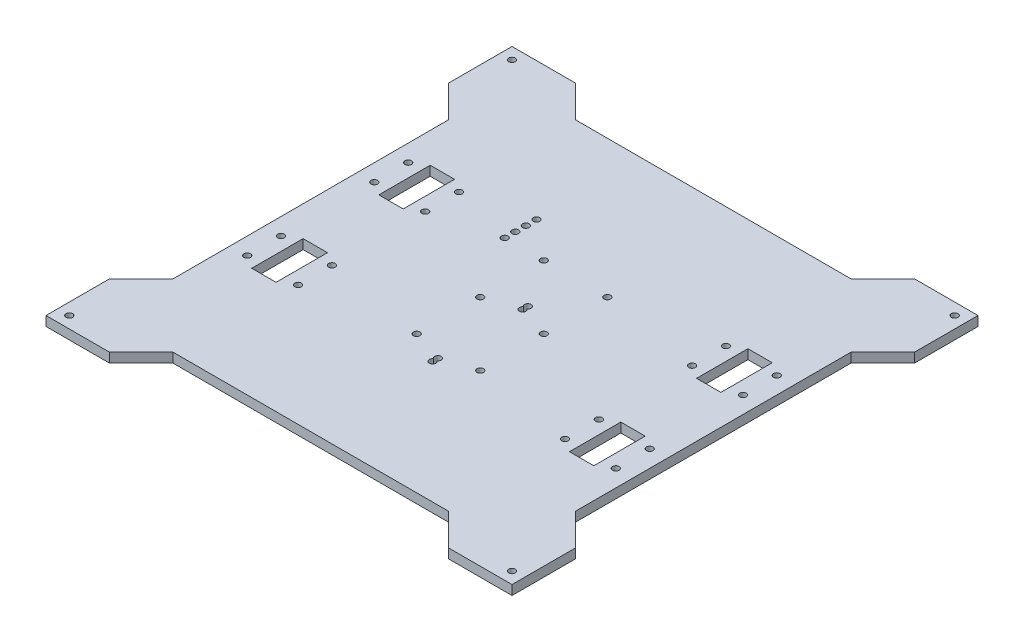
from build123d import *

# Parameters (mm, degrees)
SKETCH1_W            = 220
SKETCH1_H            = 220
SQUARE_DEPTH         = 4.5
SKETCH2_R            = 1.55
LM8UU_HOLDERS_DEPTH  = 156.628564216
SKETCH3_R            = 1.55
DEFAULTBELT_DEPTH    = 156.628564216
BELTOPTIONS_DEPTH    = 156.628564216
SKETCH5_OUTSIDE_W    = 284.232
SKETCH5_OUTSIDE_H    = 284.232
SKETCH5_OUTSIDE_R    = 1.55
SHAPING_DEPTH        = 10
SKETCH6_R            = 1.55
CUT_EXTRUDE5_DEPTH   = 156.628564216
SKETCH7_W            = 11.5
SKETCH7_H            = 24.25
CUT_EXTRUDE6_DEPTH   = 156.628564216
SKETCH8_R            = 1.55
ENDSTOPTRIGGER_DEPTH = 156.628564216
LPATTERN1_COUNT      = 2
LPATTERN1_PITCH      = 30


with BuildPart() as part:
    # Sketch1 → Square (new body)
    with BuildSketch(Plane(origin=(0, 0, 0), x_dir=(1, 0, 0), z_dir=(0, 1, 0))):
        Rectangle(SKETCH1_W, SKETCH1_H)
    extrude(amount=SQUARE_DEPTH)

    # Sketch2 → LM8UU-Holders (cut, through all)
    with BuildSketch(Plane(origin=(0, 4.5, 0), x_dir=(1, 0, 0), z_dir=(0, 1, 0))):
        with Locations((87, 38)):
            Circle(SKETCH2_R)
        with Locations((87, 22)):
            Circle(SKETCH2_R)
        with Locations((63, 22)):
            Circle(SKETCH2_R)
        with Locations((63, 38)):
            Circle(SKETCH2_R)
        with Locations((-63, 38)):
            Circle(SKETCH2_R)
        with Locations((-63, 22)):
            Circle(SKETCH2_R)
        with Locations((-87, 22)):
            Circle(SKETCH2_R)
        with Locations((-87, 38)):
            Circle(SKETCH2_R)
        with Locations((87, -22)):
            Circle(SKETCH2_R)
        with Locations((87, -38)):
            Circle(SKETCH2_R)
        with Locations((63, -38)):
            Circle(SKETCH2_R)
        with Locations((63, -22)):
            Circle(SKETCH2_R)
        with Locations((-63, -22)):
            Circle(SKETCH2_R)
        with Locations((-63, -38)):
            Circle(SKETCH2_R)
        with Locations((-87, -38)):
            Circle(SKETCH2_R)
        with Locations((-87, -22)):
            Circle(SKETCH2_R)
    extrude(amount=-LM8UU_HOLDERS_DEPTH, mode=Mode.SUBTRACT)

    # Sketch3 → DefaultBelt (cut, through all)
    with BuildSketch(Plane(origin=(0, 4.5, 0), x_dir=(1, 0, 0), z_dir=(0, 1, 0))):
        with Locations((-15, -30)):
            Circle(SKETCH3_R)
        with Locations((15, -30)):
            Circle(SKETCH3_R)
        with Locations((15, 0)):
            Circle(SKETCH3_R)
        with Locations((-15, 0)):
            Circle(SKETCH3_R)
    defaultbelt = extrude(amount=-DEFAULTBELT_DEPTH, mode=Mode.SUBTRACT)

    # Sketch4 → BeltOptions (cut, through all)
    with BuildSketch(Plane(origin=(0, 4.5, 0), x_dir=(1, 0, 0), z_dir=(0, 1, 0))):
        with BuildLine():
            ThreePointArc((-0.916515139, 6.25), (0, 3.45), (0.916515139, 6.25))
            ThreePointArc((0.916515139, 6.25), (0, 9.05), (-0.916515139, 6.25))
        make_face()
        with BuildLine():
            ThreePointArc((0.916515139, -36.25), (0, -39.05), (-0.916515139, -36.25))
            ThreePointArc((-0.916515139, -36.25), (0, -33.45), (0.916515139, -36.25))
        make_face()
    extrude(amount=-BELTOPTIONS_DEPTH, mode=Mode.SUBTRACT)

    # Sketch5 outside → Shaping (cut)
    # profile 1 of 15: a face of its own
    with BuildSketch(Plane(origin=(0, 4.5, 0), x_dir=(1, 0, 0), z_dir=(0, 1, 0))):
        Rectangle(SKETCH5_OUTSIDE_W, SKETCH5_OUTSIDE_H)
        Polygon((-80, 110), (-110, 110), (-110, 80), (-95, 65), (-95, -65), (-110, -80), (-110, -110), (-80, -110), (-65, -95), (65, -95), (80, -110), (110, -110), (110, -80), (95, -65), (95, 65), (110, 80), (110, 110), (80, 110), (65, 95), (-65, 95), align=None, mode=Mode.SUBTRACT)
    # profile 2 of 15: a face of its own
    with BuildSketch(Plane(origin=(0, 4.5, 0), x_dir=(1, 0, 0), z_dir=(0, 1, 0))):
        with Locations((-87, -38)):
            Circle(SKETCH5_OUTSIDE_R)
    # profile 3 of 15: a face of its own
    with BuildSketch(Plane(origin=(0, 4.5, 0), x_dir=(1, 0, 0), z_dir=(0, 1, 0))):
        with Locations((-63, -38)):
            Circle(SKETCH5_OUTSIDE_R)
    # profile 4 of 15: a face of its own
    with BuildSketch(Plane(origin=(0, 4.5, 0), x_dir=(1, 0, 0), z_dir=(0, 1, 0))):
        with Locations((-87, -22)):
            Circle(SKETCH5_OUTSIDE_R)
    # profile 5 of 15: a face of its own
    with BuildSketch(Plane(origin=(0, 4.5, 0), x_dir=(1, 0, 0), z_dir=(0, 1, 0))):
        with Locations((-63, -22)):
            Circle(SKETCH5_OUTSIDE_R)
    # profile 6 of 15: a face of its own
    with BuildSketch(Plane(origin=(0, 4.5, 0), x_dir=(1, 0, 0), z_dir=(0, 1, 0))):
        with Locations((15, -30)):
            Circle(SKETCH5_OUTSIDE_R)
    # profile 7 of 15: a face of its own
    with BuildSketch(Plane(origin=(0, 4.5, 0), x_dir=(1, 0, 0), z_dir=(0, 1, 0))):
        with Locations((63, -38)):
            Circle(SKETCH5_OUTSIDE_R)
    # profile 8 of 15: a face of its own
    with BuildSketch(Plane(origin=(0, 4.5, 0), x_dir=(1, 0, 0), z_dir=(0, 1, 0))):
        with Locations((87, -38)):
            Circle(SKETCH5_OUTSIDE_R)
    # profile 9 of 15: a face of its own
    with BuildSketch(Plane(origin=(0, 4.5, 0), x_dir=(1, 0, 0), z_dir=(0, 1, 0))):
        with Locations((63, -22)):
            Circle(SKETCH5_OUTSIDE_R)
    # profile 10 of 15: a face of its own
    with BuildSketch(Plane(origin=(0, 4.5, 0), x_dir=(1, 0, 0), z_dir=(0, 1, 0))):
        with Locations((-87, 22)):
            Circle(SKETCH5_OUTSIDE_R)
    # profile 11 of 15: a face of its own
    with BuildSketch(Plane(origin=(0, 4.5, 0), x_dir=(1, 0, 0), z_dir=(0, 1, 0))):
        with Locations((-63, 22)):
            Circle(SKETCH5_OUTSIDE_R)
    # profile 12 of 15: a face of its own
    with BuildSketch(Plane(origin=(0, 4.5, 0), x_dir=(1, 0, 0), z_dir=(0, 1, 0))):
        with Locations((-87, 38)):
            Circle(SKETCH5_OUTSIDE_R)
    # profile 13 of 15: a face of its own
    with BuildSketch(Plane(origin=(0, 4.5, 0), x_dir=(1, 0, 0), z_dir=(0, 1, 0))):
        with Locations((-63, 38)):
            Circle(SKETCH5_OUTSIDE_R)
    # profile 14 of 15: a face of its own
    with BuildSketch(Plane(origin=(0, 4.5, 0), x_dir=(1, 0, 0), z_dir=(0, 1, 0))):
        with Locations((87, 22)):
            Circle(SKETCH5_OUTSIDE_R)
    # profile 15 of 15: a face of its own
    with BuildSketch(Plane(origin=(0, 4.5, 0), x_dir=(1, 0, 0), z_dir=(0, 1, 0))):
        with Locations((63, 38)):
            Circle(SKETCH5_OUTSIDE_R)
    extrude(amount=-SHAPING_DEPTH, mode=Mode.SUBTRACT)

    # Sketch6 → Cut-Extrude5 (cut, through all)
    with BuildSketch(Plane(origin=(0, 4.5, 0), x_dir=(1, 0, 0), z_dir=(0, 1, 0))):
        with Locations((-104.5, 104.5)):
            Circle(SKETCH6_R)
        with Locations((104.5, 104.5)):
            Circle(SKETCH6_R)
        with Locations((104.5, -104.5)):
            Circle(SKETCH6_R)
        with Locations((-104.5, -104.5)):
            Circle(SKETCH6_R)
    extrude(amount=-CUT_EXTRUDE5_DEPTH, mode=Mode.SUBTRACT)

    # Sketch7 → Cut-Extrude6 (cut, through all)
    with BuildSketch(Plane(origin=(0, 4.5, 0), x_dir=(1, 0, 0), z_dir=(0, 1, 0))):
        with Locations((-75, 30)):
            Rectangle(SKETCH7_W, SKETCH7_H)
        with Locations((-75, -30)):
            Rectangle(SKETCH7_W, SKETCH7_H)
        with Locations((75, -30)):
            Rectangle(SKETCH7_W, SKETCH7_H)
        with Locations((75, 30)):
            Rectangle(SKETCH7_W, SKETCH7_H)
    extrude(amount=-CUT_EXTRUDE6_DEPTH, mode=Mode.SUBTRACT)

    # Sketch8 → EndstopTrigger (cut, through all)
    with BuildSketch(Plane(origin=(0, 4.5, 0), x_dir=(1, 0, 0), z_dir=(0, 1, 0))):
        with Locations((-33.45, 45)):
            Circle(SKETCH8_R)
        with Locations((-33.45, 40)):
            Circle(SKETCH8_R)
        with Locations((-33.45, 35)):
            Circle(SKETCH8_R)
        with Locations((-33.45, 30)):
            Circle(SKETCH8_R)
    extrude(amount=-ENDSTOPTRIGGER_DEPTH, mode=Mode.SUBTRACT)

    # LPattern1: DefaultBelt ×2
    with Locations(*[(0, 0, -i * LPATTERN1_PITCH) for i in range(1, LPATTERN1_COUNT)]):
        add(defaultbelt, mode=Mode.SUBTRACT)


solid = part.part
